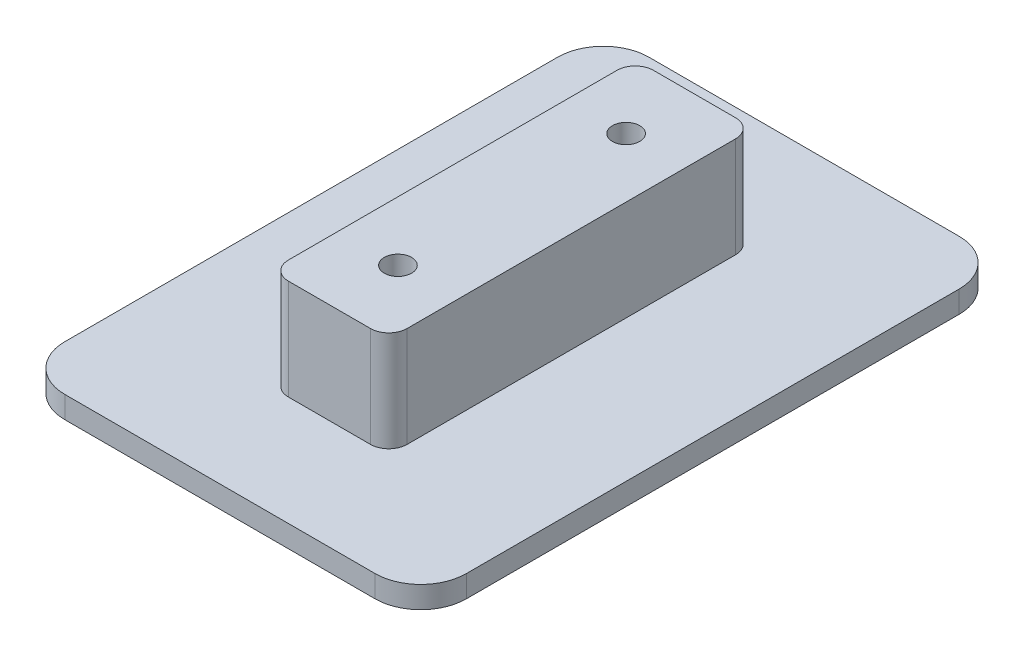
from build123d import *

# Parameters (mm, degrees)
BOSS_EXTRUDE1_DEPTH = 12
SKETCH2_R           = 7.5
BOSS_EXTRUDE2_DEPTH = 55


with BuildPart() as part:
    # Sketch1 → Boss-Extrude1 (new body)
    with BuildSketch(Plane(origin=(0, 0, 0), x_dir=(1, 0, 0), z_dir=(0, 1, 0))):
        with BuildLine():
            Line((-85, 160), (85, 160))
            ThreePointArc((85, 160), (102.67766953, 152.67766953), (110, 135))
            Line((110, 135), (110, -135))
            ThreePointArc((110, -135), (102.67766953, -152.67766953), (85, -160))
            Line((85, -160), (-85, -160))
            ThreePointArc((-85, -160), (-102.67766953, -152.67766953), (-110, -135))
            Line((-110, -135), (-110, 135))
            ThreePointArc((-110, 135), (-102.67766953, 152.67766953), (-85, 160))
        make_face()
    extrude(amount=BOSS_EXTRUDE1_DEPTH)

    # Sketch2 → Boss-Extrude2 (add)
    with BuildSketch(Plane(origin=(0, 12, 0), x_dir=(1, 0, 0), z_dir=(0, 1, 0))):
        with BuildLine():
            Line((-22.5, 100), (22.5, 100))
            ThreePointArc((22.5, 100), (29.571067812, 97.071067812), (32.5, 90))
            Line((32.5, 90), (32.5, -90))
            ThreePointArc((32.5, -90), (29.571067812, -97.071067812), (22.5, -100))
            Line((22.5, -100), (-22.5, -100))
            ThreePointArc((-22.5, -100), (-29.571067812, -97.071067812), (-32.5, -90))
            Line((-32.5, -90), (-32.5, 90))
            ThreePointArc((-32.5, 90), (-29.571067812, 97.071067812), (-22.5, 100))
        make_face()
        with Locations(Location((0, 62.5, 0), (0, 0, 270))):
            Circle(SKETCH2_R, mode=Mode.SUBTRACT)
        with Locations(Location((0, -62.5, 0), (0, 0, 270))):
            Circle(SKETCH2_R, mode=Mode.SUBTRACT)
    extrude(amount=BOSS_EXTRUDE2_DEPTH)


solid = part.part
